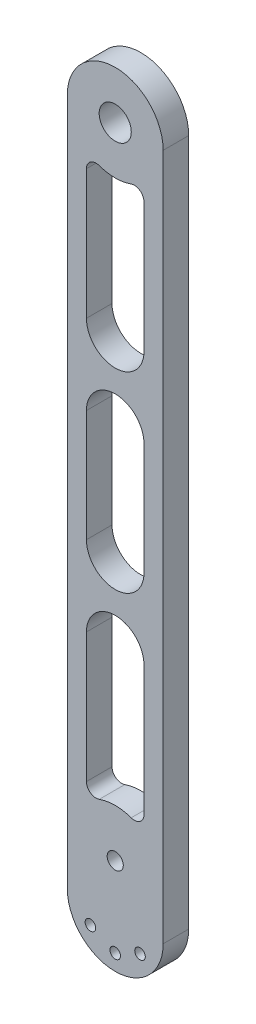
from build123d import *

# Parameters (mm, degrees)
SKETCH_1_R      = 5.025
SKETCH_1_R_2    = 2.525
EXTRUDE_1_DEPTH = 8
SKETCH_2_R      = 1.65
EXTRUDE_2_DEPTH = 8


with BuildPart() as part:
    # 草图1 → 凸台-拉伸1 (new body)
    with BuildSketch(Plane.XY):
        with BuildLine():
            Line((-15, 0), (-15, -200))
            ThreePointArc((-15, -200), (0, -215), (15, -200))
            Line((15, -200), (15, 0))
            ThreePointArc((15, 0), (0, 15), (-15, 0))
        make_face()
        Circle(SKETCH_1_R, mode=Mode.SUBTRACT)
        with Locations((0, -200)):
            Circle(SKETCH_1_R_2, mode=Mode.SUBTRACT)
        with BuildLine():
            Line((-9, -16.970562748), (-9, -57.5))
            ThreePointArc((-9, -57.5), (0, -66.5), (9, -57.5))
            Line((9, -57.5), (9, -16.970562748))
            ThreePointArc((9, -16.970562748), (7.732050808, -14.521073006), (5, -14.142135624))
            ThreePointArc((5, -14.142135624), (0, -15), (-5, -14.142135624))
            ThreePointArc((-5, -14.142135624), (-7.732050808, -14.521073006), (-9, -16.970562748))
        make_face(mode=Mode.SUBTRACT)
        with BuildLine():
            Line((9, -82.5), (9, -117.5))
            ThreePointArc((9, -117.5), (0, -126.5), (-9, -117.5))
            Line((-9, -117.5), (-9, -82.5))
            ThreePointArc((-9, -82.5), (0, -73.5), (9, -82.5))
        make_face(mode=Mode.SUBTRACT)
        with BuildLine():
            Line((-9, -183.029437252), (-9, -142.5))
            ThreePointArc((-9, -142.5), (0, -133.5), (9, -142.5))
            Line((9, -142.5), (9, -183.029437252))
            ThreePointArc((9, -183.029437252), (7.732050808, -185.478926994), (5, -185.857864376))
            ThreePointArc((5, -185.857864376), (0, -185), (-5, -185.857864376))
            ThreePointArc((-5, -185.857864376), (-7.732050808, -185.478926994), (-9, -183.029437252))
        make_face(mode=Mode.SUBTRACT)
    extrude(amount=EXTRUDE_1_DEPTH)

    # 草图2 → 凸台-拉伸2 (add, through all)
    with BuildSketch(Plane.XY):
        with BuildLine():
            Line((-15, -200), (-15, -215))
            ThreePointArc((-15, -215), (0, -230), (15, -215))
            Line((15, -215), (15, -200))
            ThreePointArc((15, -200), (0, -215), (-15, -200))
        make_face()
        with Locations((0, -225)):
            Circle(SKETCH_2_R, mode=Mode.SUBTRACT)
        with Locations((-7.756707253, -221.311378027)):
            Circle(SKETCH_2_R, mode=Mode.SUBTRACT)
        with Locations((7.756707253, -221.311378027)):
            Circle(SKETCH_2_R, mode=Mode.SUBTRACT)
    extrude(amount=EXTRUDE_2_DEPTH)


solid = part.part
